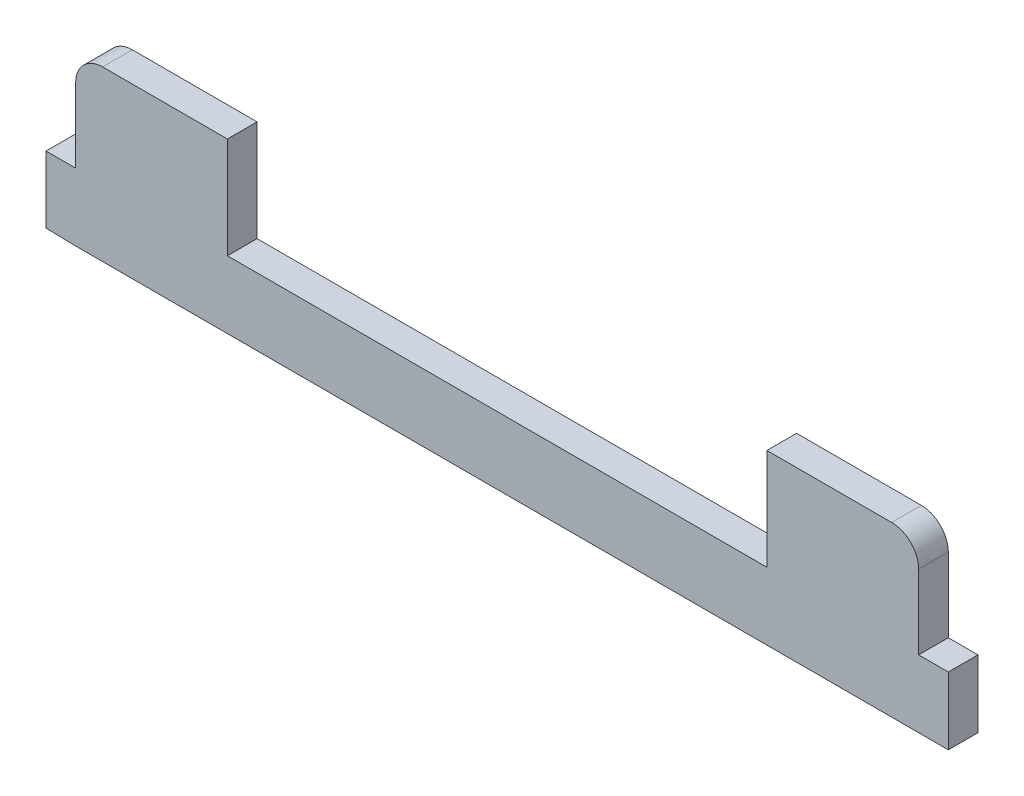
from build123d import *

# Parameters (mm, degrees)
BOSS_EXTRUDE1_DEPTH = 2.794
FILLET1_R           = 2.54


with BuildPart() as part:
    # Sketch1 → Boss-Extrude1 (new body)
    with BuildSketch(Plane.XY):
        Polygon((-4.201711417, 0), (75.173288583, 0), (77.967288583, 0), (77.967288583, 6.35), (75.173288583, 6.35), (75.173288583, 15.875), (60.885788583, 15.875), (60.885788583, 6.35), (10.085788583, 6.35), (10.085788583, 15.875), (-4.201711417, 15.875), (-4.201711417, 6.35), (-6.995711417, 6.35), (-6.995711417, 0.062112437), align=None)
    extrude(amount=BOSS_EXTRUDE1_DEPTH)

    # Fillet1
    fillet1_edges = [part.edges().sort_by_distance(p)[0] for p in [
        (-4.201711417, 15.875, 1.397),
        (75.173288583, 15.875, 1.397),
    ]]
    fillet(fillet1_edges, radius=FILLET1_R)


solid = part.part
